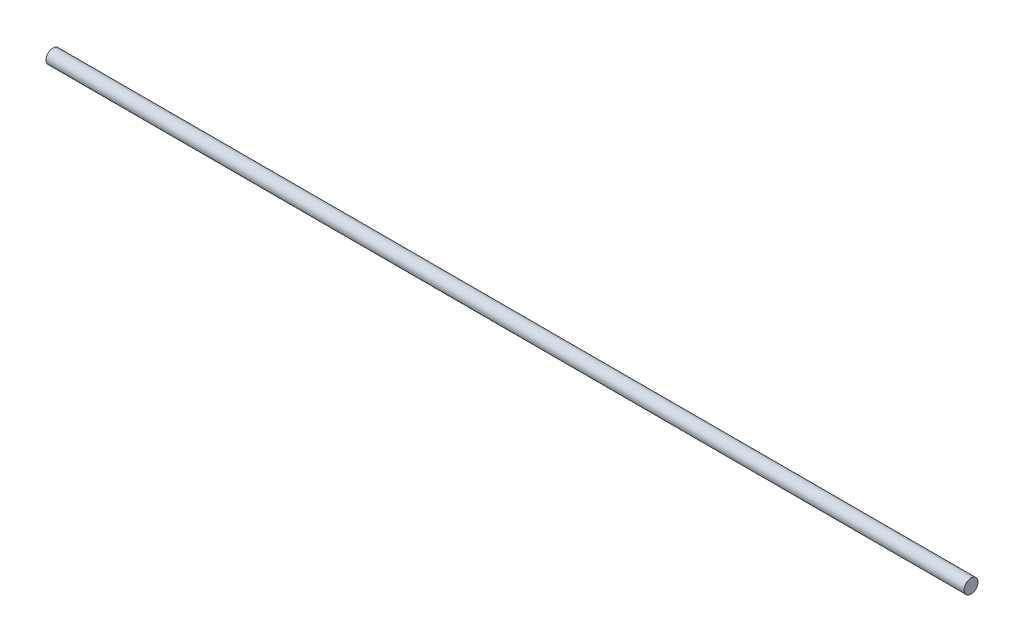
from build123d import *

# Parameters (mm, degrees)
SKETCH1_R           = 3.8
BOSS_EXTRUDE1_DEPTH = 501.65


with BuildPart() as part:
    # Sketch1 → Boss-Extrude1 (new body)
    with BuildSketch(Plane(origin=(0, 0, 0), x_dir=(0, 0, -1), z_dir=(1, 0, 0))):
        Circle(SKETCH1_R)
    extrude(amount=BOSS_EXTRUDE1_DEPTH)


solid = part.part
